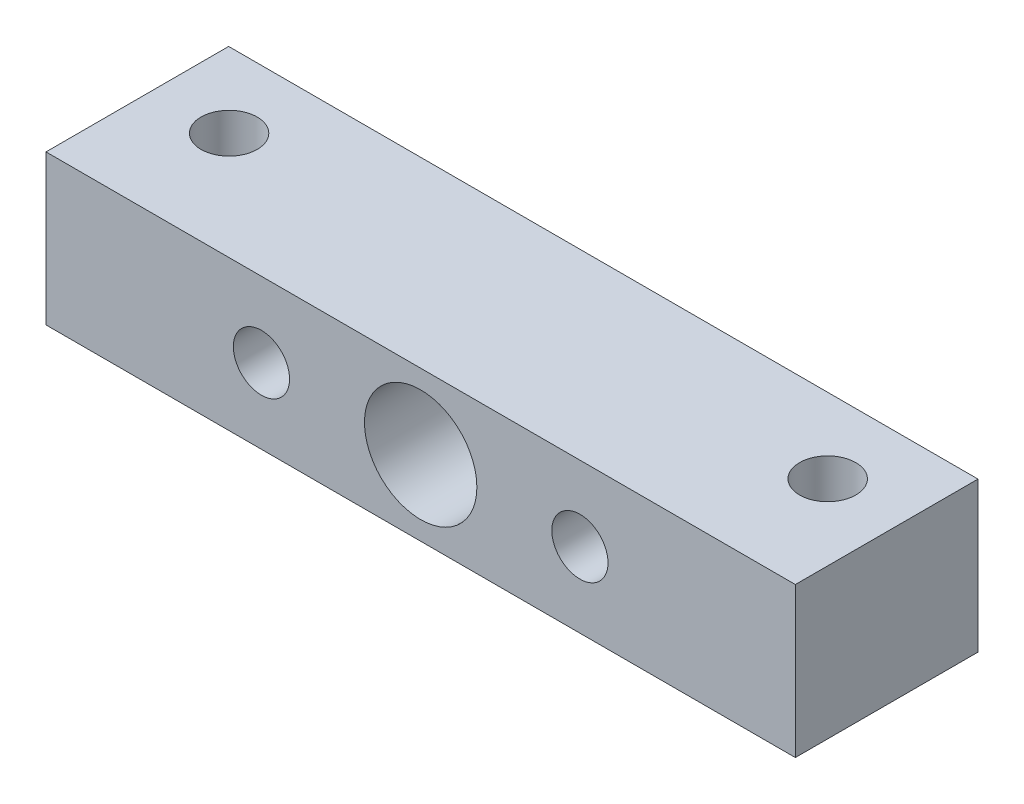
from build123d import *

# Parameters (mm, degrees)
SKETCH1_W           = 40
SKETCH1_H           = 9.75
SKETCH1_R           = 1.5
BOSS_EXTRUDE1_DEPTH = 8
CUT_EXTRUDE1_REACH  = 25.645
SKETCH2_R           = 3
SKETCH2_R_2         = 1.5


with BuildPart() as part:
    # Sketch1 → Boss-Extrude1 (new body)
    with BuildSketch(Plane(origin=(0, 0, 0), x_dir=(1, 0, 0), z_dir=(0, 1, 0))):
        Rectangle(SKETCH1_W, SKETCH1_H)
        with Locations(Location((-15.976056303, 0.875, 0), (0, 0, 270))):
            Circle(SKETCH1_R, mode=Mode.SUBTRACT)
        with Locations(Location((15.976056303, 0.875, 0), (0, 0, 90))):
            Circle(SKETCH1_R, mode=Mode.SUBTRACT)
    extrude(amount=BOSS_EXTRUDE1_DEPTH)

    # Sketch2 → Cut-Extrude1 (cut, up to next)
    with BuildSketch(Plane.XY.offset(4.875), mode=Mode.PRIVATE) as cut_extrude1_sk1:
        with Locations((0, 4)):
            Circle(SKETCH2_R)
    cut_extrude1_tool1 = extrude(cut_extrude1_sk1.sketch, amount=-CUT_EXTRUDE1_REACH, mode=Mode.PRIVATE) & part.part
    # Sketch2 → Cut-Extrude1 (cut, up to next)
    with BuildSketch(Plane.XY.offset(4.875), mode=Mode.PRIVATE) as cut_extrude1_sk2:
        with Locations((8.5, 4)):
            Circle(SKETCH2_R_2)
    cut_extrude1_tool2 = extrude(cut_extrude1_sk2.sketch, amount=-CUT_EXTRUDE1_REACH, mode=Mode.PRIVATE) & part.part
    # Sketch2 → Cut-Extrude1 (cut, up to next)
    with BuildSketch(Plane.XY.offset(4.875), mode=Mode.PRIVATE) as cut_extrude1_sk3:
        with Locations((-8.5, 4)):
            Circle(SKETCH2_R_2)
    cut_extrude1_tool3 = extrude(cut_extrude1_sk3.sketch, amount=-CUT_EXTRUDE1_REACH, mode=Mode.PRIVATE) & part.part
    add(cut_extrude1_tool1.solids().sort_by_distance((0, 4, 4.875))[0], mode=Mode.SUBTRACT)
    add(cut_extrude1_tool2.solids().sort_by_distance((8.5, 4, 4.875))[0], mode=Mode.SUBTRACT)
    add(cut_extrude1_tool3.solids().sort_by_distance((-8.5, 4, 4.875))[0], mode=Mode.SUBTRACT)


solid = part.part
